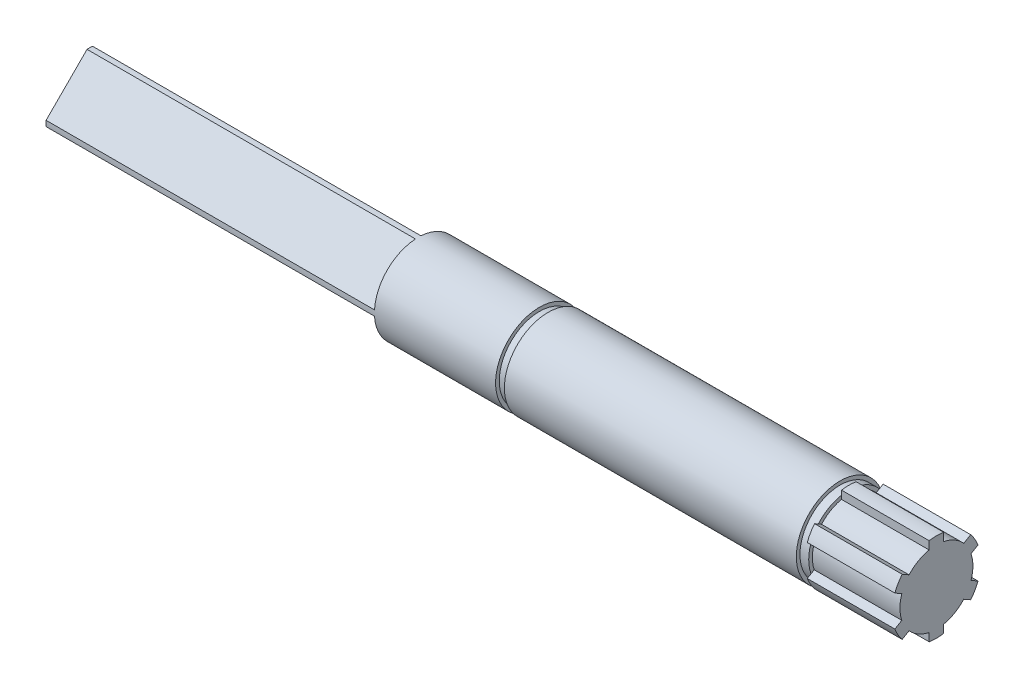
from build123d import *

# Parameters (mm, degrees)
EXTRUDE_1_DEPTH          = 45
SKETCH_2_R               = 6
EXTRUDE_2_DEPTH          = 16.6
SKETCH_3_R               = 5.5
EXTRUDE_3_DEPTH          = 1.2
SKETCH_4_R               = 6
EXTRUDE_4_DEPTH          = 40
SKETCH_5_R               = 5.5
EXTRUDE_5_DEPTH          = 1.2
SKETCH_6_R               = 7
EXTRUDE_6_DEPTH          = 12
CUT_EXTRUDE_1_DEPTH      = 12
PATTERN_CIRCULAR_1_COUNT = 6
SKETCH_9_OUTSIDE_W       = 38.206
SKETCH_9_OUTSIDE_H       = 38.206
SKETCH_9_OUTSIDE_R       = 6
CUT_EXTRUDE_2_DEPTH      = 72.56814934
SKETCH_13_R              = 1.29930571
CUT_EXTRUDE_3_DEPTH      = 12


with BuildPart() as part:
    # 草图1 → 凸台-拉伸1 (new body)
    with BuildSketch(Plane(origin=(0, 0, 0), x_dir=(0, 0, -1), z_dir=(1, 0, 0))):
        Polygon((6.363961031, 0), (0, 6.363961031), (-6.363961031, 0), (0, -6.363961031), align=None)
    extrude(amount=EXTRUDE_1_DEPTH)

    # 草图2 → 凸台-拉伸2 (add)
    with BuildSketch(Plane(origin=(45, 0, 0), x_dir=(0, 0, -1), z_dir=(1, 0, 0))):
        Circle(SKETCH_2_R)
    extrude(amount=EXTRUDE_2_DEPTH)

    # 草图3 → 凸台-拉伸3 (add)
    with BuildSketch(Plane(origin=(61.6, 0, 0), x_dir=(0, 0, -1), z_dir=(1, 0, 0))):
        Circle(SKETCH_3_R)
    extrude(amount=EXTRUDE_3_DEPTH)

    # 草图4 → 凸台-拉伸4 (add)
    with BuildSketch(Plane(origin=(62.8, 0, 0), x_dir=(0, 0, -1), z_dir=(1, 0, 0))):
        Circle(SKETCH_4_R)
    extrude(amount=EXTRUDE_4_DEPTH)

    # 草图5 → 凸台-拉伸5 (add)
    with BuildSketch(Plane(origin=(102.8, 0, 0), x_dir=(0, 0, -1), z_dir=(1, 0, 0))):
        Circle(SKETCH_5_R)
    extrude(amount=EXTRUDE_5_DEPTH)

    # 草图6 → 凸台-拉伸6 (add)
    with BuildSketch(Plane(origin=(104, 0, 0), x_dir=(0, 0, -1), z_dir=(1, 0, 0))):
        Circle(SKETCH_6_R)
    extrude(amount=EXTRUDE_6_DEPTH)

    # 草图7 → 切除-拉伸1 (cut)
    with BuildSketch(Plane(origin=(116, 0, 0), x_dir=(0, 0, -1), z_dir=(1, 0, 0))):
        with BuildLine():
            Line((1, 6), (1, 4.898979486))
            ThreePointArc((1, 4.898979486), (1.772963136, 4.675104461), (2.5, 4.330127019))
            Line((2.5, 4.330127019), (5, 8.660254038))
            ThreePointArc((5, 8.660254038), (0, 10), (-5, 8.660254038))
            Line((-5, 8.660254038), (-2.5, 4.330127019))
            ThreePointArc((-2.5, 4.330127019), (-1.772963136, 4.675104461), (-1, 4.898979486))
            Line((-1, 4.898979486), (-1, 6))
            ThreePointArc((-1, 6), (0, 6.08276253), (1, 6))
        make_face()
    cut_extrude_1 = extrude(amount=-CUT_EXTRUDE_1_DEPTH, mode=Mode.SUBTRACT)

    # 阵列(圆周)1: 切除-拉伸1 ×6 about axis
    pattern_circular_1_axis = Axis((88.99, 0, 0), (-1, 0, 0))
    for i in range(1, PATTERN_CIRCULAR_1_COUNT):
        add(cut_extrude_1.rotate(pattern_circular_1_axis, i * 360 / PATTERN_CIRCULAR_1_COUNT), mode=Mode.SUBTRACT)

    # 草图9 outside → 切除-拉伸2 (cut, through all)
    with BuildSketch(Plane.ZY.offset(-45)):
        Rectangle(SKETCH_9_OUTSIDE_W, SKETCH_9_OUTSIDE_H)
        Circle(SKETCH_9_OUTSIDE_R, mode=Mode.SUBTRACT)
    extrude(amount=CUT_EXTRUDE_2_DEPTH, mode=Mode.SUBTRACT)

    # 草图13 → 切除-拉伸3 (cut)
    with BuildSketch(Plane.ZY):
        Circle(SKETCH_13_R)
    extrude(amount=-CUT_EXTRUDE_3_DEPTH, mode=Mode.SUBTRACT)


solid = part.part
